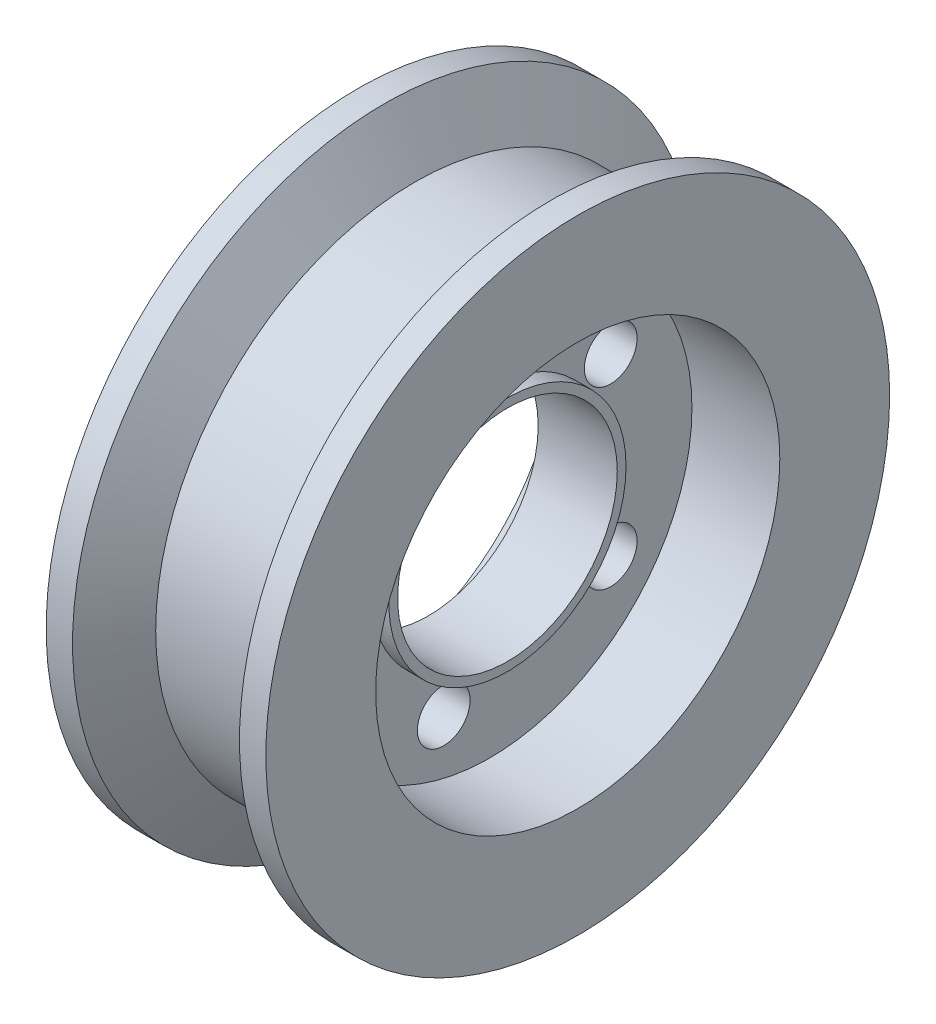
from build123d import *

# Parameters (mm, degrees)
SKETCH2_R                = 35.5
SKETCH2_R_2              = 12.5
BOSS_EXTRUDE1_DEPTH      = 12.5
SKETCH4_R                = 23
CUT_EXTRUDE1_DEPTH       = 10
SKETCH5_R                = 3
CUT_EXTRUDE2_DEPTH       = 53.397519025
CIRPATTERN1_COUNT        = 5
BOSS_EXTRUDE2_DEPTH      = 2
BOSS_EXTRUDE2_DEPTH_BACK = 7
SKETCH6_R                = 13.5
SKETCH6_R_2              = 12.5


with BuildPart() as part:
    # Sketch2 → Boss-Extrude1 (new, symmetric)
    with BuildSketch(Plane.YZ):
        with Locations(Location((0, 0, 0), (0, 0, 270))):
            Circle(SKETCH2_R)
        with Locations(Location((0, 0, 0), (0, 0, 270))):
            Circle(SKETCH2_R_2, mode=Mode.SUBTRACT)
    extrude(amount=BOSS_EXTRUDE1_DEPTH, both=True)

    # Sketch4 → Cut-Extrude1 (cut)
    with BuildSketch(Plane.YZ.offset(12.5)):
        with Locations(Location((0, 0, 0), (0, 0, 270))):
            Circle(SKETCH4_R)
    cut_extrude1 = extrude(amount=-CUT_EXTRUDE1_DEPTH, mode=Mode.SUBTRACT)

    # Mirror1: Cut-Extrude1 across plane
    add(cut_extrude1.mirror(Plane(origin=(0, 0, 0), x_dir=(0, 0, 1), z_dir=(1, 0, 0))), mode=Mode.SUBTRACT)

    # Sketch5 → Cut-Extrude2 (cut, through all)
    with BuildSketch(Plane.YZ.offset(2.5)):
        with Locations(Location((0, 17, 0), (0, 0, 270))):
            Circle(SKETCH5_R)
    cut_extrude2 = extrude(amount=-CUT_EXTRUDE2_DEPTH, mode=Mode.SUBTRACT)

    # CirPattern1: Cut-Extrude2 ×5 about axis
    cirpattern1_axis = Axis((0, 0, 0), (1, 0, 0))
    for i in range(1, CIRPATTERN1_COUNT):
        add(cut_extrude2.rotate(cirpattern1_axis, i * 360 / CIRPATTERN1_COUNT), mode=Mode.SUBTRACT)

    # Sketch6 → Boss-Extrude2 (add, two sides: drawn at the far end of the back side and taken through both)
    with BuildSketch(Plane.YZ.offset(2.5).offset(-BOSS_EXTRUDE2_DEPTH_BACK)):
        with Locations(Location((0, 0, 0), (0, 0, 270))):
            Circle(SKETCH6_R)
        with Locations(Location((0, 0, 0), (0, 0, 270))):
            Circle(SKETCH6_R_2, mode=Mode.SUBTRACT)
    extrude(amount=BOSS_EXTRUDE2_DEPTH + BOSS_EXTRUDE2_DEPTH_BACK)

    # Sketch7 → Cut-Revolve1 (revolve, cut)
    with BuildSketch(Plane(origin=(0, 0, 0), x_dir=(0, 1, 0), z_dir=(0, 0, 1)), mode=Mode.PRIVATE) as cut_revolve1_sk:
        Polygon((-35.5, 9.5), (-29.5, 6.035898385), (-29.5, -6.035898385), (-35.5, -9.5), align=None)
    revolve(cut_revolve1_sk.sketch.rotate(Axis((0, 0, 0), (-1, 0, 0)), 270), axis=Axis((0, 0, 0), (-1, 0, 0)), mode=Mode.SUBTRACT)


solid = part.part
